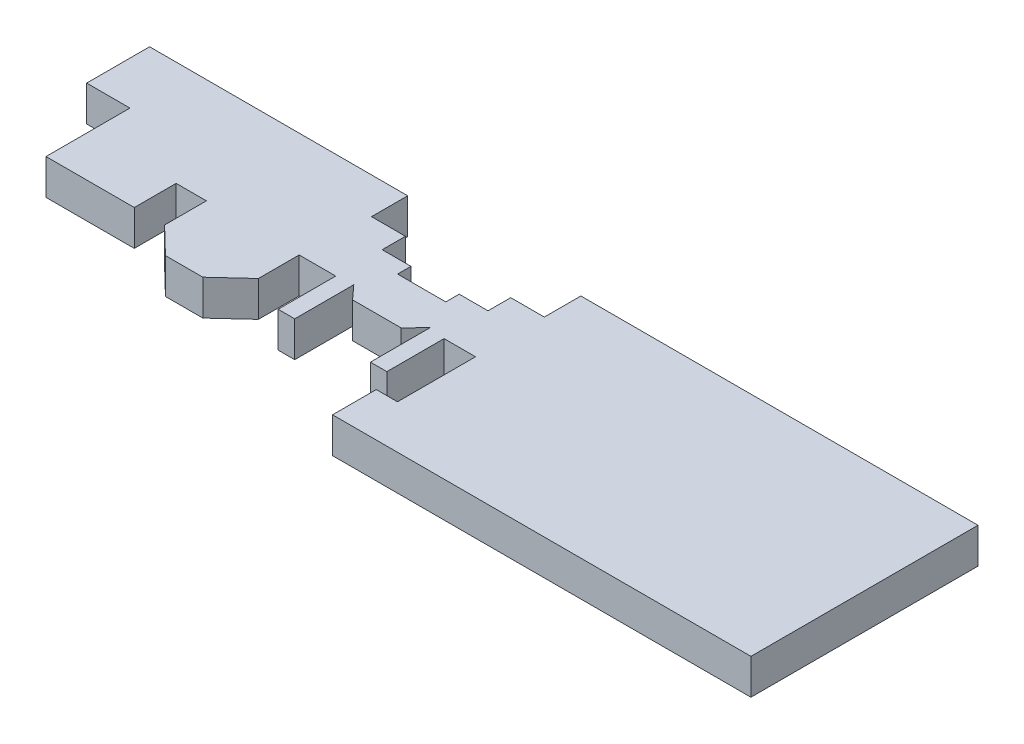
from build123d import *

# Parameters (mm, degrees)
BOSS_EXTRUDE1_DEPTH     = 4100
CUT_EXTRUDE2_DEPTH      = 360
CUT_EXTRUDE2_DEPTH_BACK = 1000
SKETCH8_W               = 4000
SKETCH8_H               = 1574.725224171
BOSS_EXTRUDE2_DEPTH     = 400
SKETCH10_W              = 4000
SKETCH10_H              = 1574.725224171
BOSS_EXTRUDE3_DEPTH     = 150


with BuildPart() as part:
    # Sketch5 → Boss-Extrude1 (new body)
    with BuildSketch(Plane(origin=(0, 0, 0), x_dir=(1, 0, 0), z_dir=(0, 1, 0))):
        Polygon((-92722.442891537, 3032.5434193), (-92722.442891537, -4248.037983208), (-87714.630252684, -4248.037983208), (-87714.630252684, -13961.448907134), (-77497.684007523, -13961.448907134), (-77497.684007523, -9120.831801635), (-73993.999245447, -9120.831801635), (-73993.999245447, -13961.448907134), (-70874.353647814, -16978.243851345), (-66551.436516177, -16978.243851345), (-63204.037171957, -13893.822161368), (-63204.037171957, -9177.535874451), (-58974.210587207, -9177.535874451), (-58974.210587207, -15834.789027484), (-57060.499737676, -15834.789027484), (-57060.499737676, -8999.658062996), (-55614.702387222, -10587.318993272), (-49997.826624289, -10587.318993272), (-48338.773974021, -8876.998824422), (-48338.773974021, -15794.435779887), (-46437.441187314, -15794.435779887), (-46437.441187314, -9177.535874451), (-42795.906953804, -9177.535874451), (-42795.906953804, -18201.935134033), (-45253.433289974, -18201.935134033), (-45253.433289974, -23262.658838668), (3158.957531363, -23262.658838668), (3158.957531363, 3013.360006537), (-42795.906953804, 3013.360006537), (-42795.906953804, -1217.323428695), (-46681.290684555, -1217.323428695), (-46681.290684555, -3848.072569742), (-50014.557417966, -3848.072569742), (-50014.557417966, -5398.429189933), (-55593.77624448, -5398.429189933), (-55593.77624448, -3848.072569742), (-58927.042977891, -3848.072569742), (-58927.042977891, -1153.615193648), (-62854.969491775, -1153.615193648), (-62854.969491775, 3032.5434193), align=None)
    extrude(amount=BOSS_EXTRUDE1_DEPTH)

    # Sketch8 → Cut-Extrude2 (cut, two sides: drawn at the far end of the back side and taken through both)
    with BuildSketch(Plane(origin=(0, 0, -3022.951712918), x_dir=(-1, 0, 0), z_dir=(0, 0, -1)).offset(-CUT_EXTRUDE2_DEPTH_BACK)):
        with Locations((5231.252465647, 2315.293735901)):
            Rectangle(SKETCH8_W, SKETCH8_H)
        with Locations((-28.405935853, 2315.293735901)):
            Rectangle(SKETCH8_W, SKETCH8_H)
        with Locations((15815.636386773, 2315.293735901)):
            Rectangle(SKETCH8_W, SKETCH8_H)
        with Locations((10555.977985272, 2315.293735901)):
            Rectangle(SKETCH8_W, SKETCH8_H)
        with Locations((23763.886231613, 2315.293735901)):
            Rectangle(SKETCH8_W, SKETCH8_H)
        with Locations((39607.928554239, 2315.293735901)):
            Rectangle(SKETCH8_W, SKETCH8_H)
        with Locations((29023.544633113, 2315.293735901)):
            Rectangle(SKETCH8_W, SKETCH8_H)
        with Locations((34348.270152738, 2315.293735901)):
            Rectangle(SKETCH8_W, SKETCH8_H)
        with Locations((72871.270372947, 2315.293735901)):
            Rectangle(SKETCH8_W, SKETCH8_H)
        with Locations((83455.654294073, 2315.293735901)):
            Rectangle(SKETCH8_W, SKETCH8_H)
        with Locations((88715.312695573, 2315.293735901)):
            Rectangle(SKETCH8_W, SKETCH8_H)
        with Locations((78130.928774448, 2315.293735901)):
            Rectangle(SKETCH8_W, SKETCH8_H)
        with Locations((67598.858524863, 2315.293735901)):
            Rectangle(SKETCH8_W, SKETCH8_H)
    extrude(amount=CUT_EXTRUDE2_DEPTH + CUT_EXTRUDE2_DEPTH_BACK, mode=Mode.SUBTRACT)

    # Sketch11 → Boss-Extrude2 (add)
    with BuildSketch(Plane(origin=(0, 4100, 0), x_dir=(1, 0, 0), z_dir=(0, 1, 0))):
        Polygon((-92722.442891537, 3032.5434193), (-92722.442891537, -4248.037983208), (-87714.630252684, -4248.037983208), (-87714.630252684, -13961.448907134), (-77497.684007523, -13961.448907134), (-77497.684007523, -9120.831801635), (-73993.999245447, -9120.831801635), (-73993.999245447, -13961.448907134), (-70874.353647814, -16978.243851345), (-66551.436516177, -16978.243851345), (-63204.037171957, -13893.822161368), (-63204.037171957, -9177.535874451), (-58974.210587207, -9177.535874451), (-58974.210587207, -15834.789027484), (-57060.499737676, -15834.789027484), (-57060.499737676, -8999.658062996), (-55614.702387222, -10587.318993272), (-49997.826624289, -10587.318993272), (-48338.773974021, -8876.998824422), (-48338.773974021, -15794.435779887), (-46437.441187314, -15794.435779887), (-46437.441187314, -9177.535874451), (-42795.906953804, -9177.535874451), (-42795.906953804, -18201.935134033), (-45253.433289974, -18201.935134033), (-45253.433289974, -23262.658838668), (3158.957531363, -23262.658838668), (3158.957531363, 3013.360006537), (-42795.906953804, 3013.360006537), (-42795.906953804, -1217.323428695), (-44543.949233842, -1217.323428695), (-46460.002030968, -1217.323428695), (-46460.002030968, -4121.47924984), (-49725.652353067, -4121.47924984), (-49725.652353067, -5665.367364151), (-55960.882280047, -5665.367364151), (-55960.882280047, -4121.47924984), (-59226.532602146, -4121.47924984), (-59226.532602146, -1153.615193648), (-61139.275030104, -1153.615193648), (-62854.969491775, -1153.615193648), (-62854.969491775, 3032.5434193), align=None)
        with BuildLine():
            Line((-62020.014054855, -5163.687596874), (-62020.014054855, -5388.888998251))
            Line((-62020.014054855, -5388.888998251), (-61911.509537571, -5388.888998251))
            Line((-61911.509537571, -5388.888998251), (-61911.509537571, -5437.542435503))
            Line((-61911.509537571, -5437.542435503), (-61719.175469751, -5437.542435503))
            Line((-61719.175469751, -5437.542435503), (-61719.175469751, -5388.888998251))
            Line((-61719.175469751, -5388.888998251), (-61612.078613853, -5388.888998251))
            Line((-61612.078613853, -5388.888998251), (-61612.078613853, -5163.687596874))
            ThreePointArc((-61612.078613853, -5163.687596874), (-61626.723274794, -5128.332257815), (-61662.078613853, -5113.687596874))
            Line((-61662.078613853, -5113.687596874), (-61970.014054855, -5113.687596874))
            ThreePointArc((-61970.014054855, -5113.687596874), (-62005.369393914, -5128.332257815), (-62020.014054855, -5163.687596874))
        make_face(mode=Mode.SUBTRACT)
    extrude(amount=-BOSS_EXTRUDE2_DEPTH)

    # Sketch10 → Boss-Extrude3 (add)
    with BuildSketch(Plane(origin=(0, 0, -3022.951712918), x_dir=(-1, 0, 0), z_dir=(0, 0, -1))):
        with Locations((5231.252465647, 2315.293735901)):
            Rectangle(SKETCH10_W, SKETCH10_H)
        with Locations((-28.405935853, 2315.293735901)):
            Rectangle(SKETCH10_W, SKETCH10_H)
        with Locations((15815.636386773, 2315.293735901)):
            Rectangle(SKETCH10_W, SKETCH10_H)
        with Locations((10555.977985272, 2315.293735901)):
            Rectangle(SKETCH10_W, SKETCH10_H)
        with Locations((23763.886231613, 2315.293735901)):
            Rectangle(SKETCH10_W, SKETCH10_H)
        with Locations((39607.928554239, 2315.293735901)):
            Rectangle(SKETCH10_W, SKETCH10_H)
        with Locations((29023.544633113, 2315.293735901)):
            Rectangle(SKETCH10_W, SKETCH10_H)
        with Locations((34348.270152738, 2315.293735901)):
            Rectangle(SKETCH10_W, SKETCH10_H)
        with Locations((72871.270372947, 2315.293735901)):
            Rectangle(SKETCH10_W, SKETCH10_H)
        with Locations((83455.654294073, 2315.293735901)):
            Rectangle(SKETCH10_W, SKETCH10_H)
        with Locations((88715.312695573, 2315.293735901)):
            Rectangle(SKETCH10_W, SKETCH10_H)
        with Locations((78130.928774448, 2315.293735901)):
            Rectangle(SKETCH10_W, SKETCH10_H)
        with Locations((67598.858524863, 2315.293735901)):
            Rectangle(SKETCH10_W, SKETCH10_H)
    extrude(amount=-BOSS_EXTRUDE3_DEPTH)


solid = part.part
